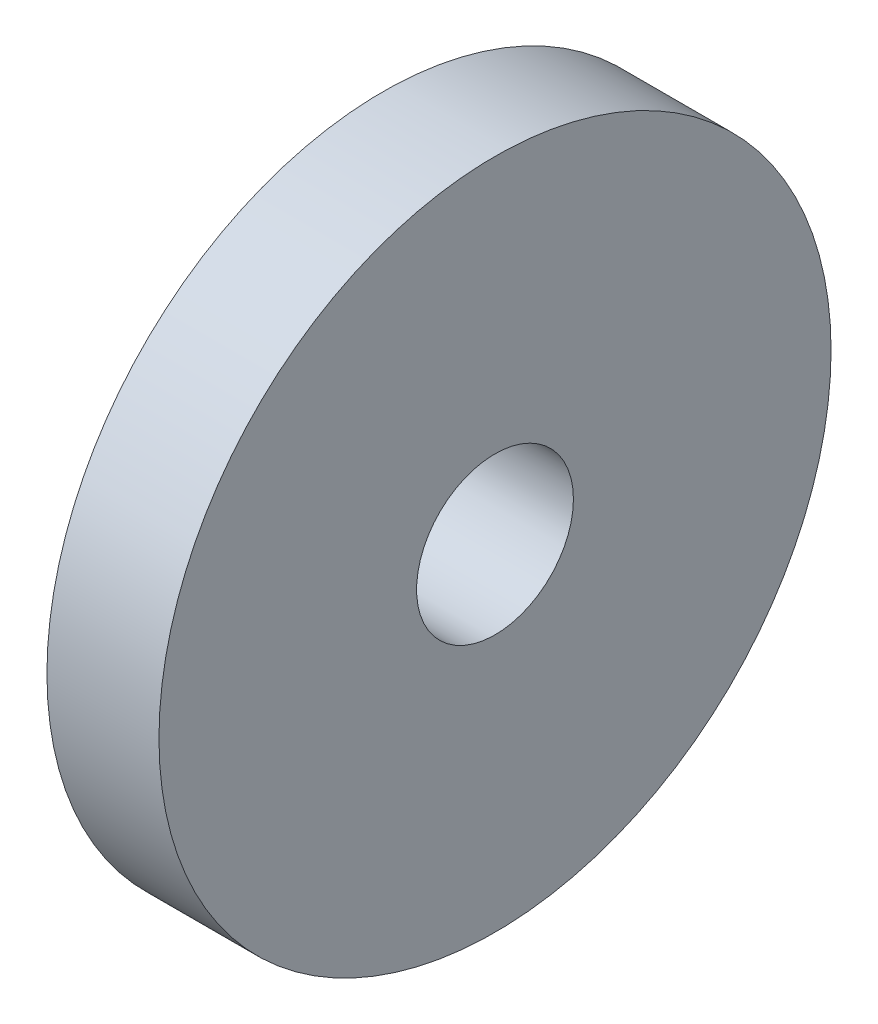
from build123d import *

# Parameters (mm, degrees)
SKETCH1_R           = 30
SKETCH1_R_2         = 7
BOSS_EXTRUDE1_DEPTH = 5


with BuildPart() as part:
    # Sketch1 → Boss-Extrude1 (new, symmetric)
    with BuildSketch(Plane(origin=(0, 0, 0), x_dir=(0, 0, -1), z_dir=(1, 0, 0))):
        Circle(SKETCH1_R)
        Circle(SKETCH1_R_2, mode=Mode.SUBTRACT)
    extrude(amount=BOSS_EXTRUDE1_DEPTH, both=True)


solid = part.part
